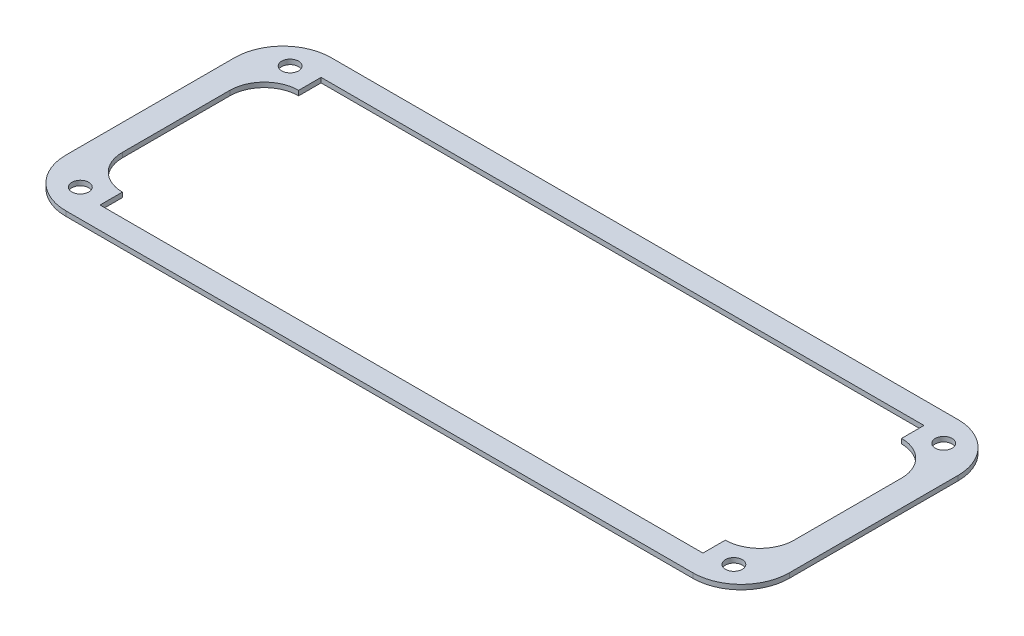
from build123d import *

# Parameters (mm, degrees)
SKETCH1_R           = 1.75
BOSS_EXTRUDE1_DEPTH = 1


with BuildPart() as part:
    # Sketch1 → Boss-Extrude1 (new body)
    with BuildSketch(Plane(origin=(0, 0, 0), x_dir=(1, 0, 0), z_dir=(0, 1, 0))):
        with BuildLine():
            Line((132.75, -5.75), (2.75, -5.75))
            ThreePointArc((2.75, -5.75), (-4.321067812, -2.821067812), (-7.25, 4.25))
            Line((-7.25, 4.25), (-7.25, 39.25))
            ThreePointArc((-7.25, 39.25), (-4.321067812, 46.321067812), (2.75, 49.25))
            Line((2.75, 49.25), (132.75, 49.25))
            ThreePointArc((132.75, 49.25), (139.821067812, 46.321067812), (142.75, 39.25))
            Line((142.75, 39.25), (142.75, 4.25))
            ThreePointArc((142.75, 4.25), (139.821067812, -2.821067812), (132.75, -5.75))
        make_face()
        with Locations(Location((0, 0, 0), (0, 0, 270))):
            Circle(SKETCH1_R, mode=Mode.SUBTRACT)
        with Locations(Location((0, 43.5, 0), (0, 0, 270))):
            Circle(SKETCH1_R, mode=Mode.SUBTRACT)
        with Locations(Location((135.5, 43.5, 0), (0, 0, 270))):
            Circle(SKETCH1_R, mode=Mode.SUBTRACT)
        with Locations(Location((135.5, 0, 0), (0, 0, 270))):
            Circle(SKETCH1_R, mode=Mode.SUBTRACT)
        with BuildLine():
            Line((130.25, 40.016443463), (130.25, 44.666666667))
            Line((130.25, 44.666666667), (5.25, 44.666666667))
            Line((5.25, 44.666666667), (5.25, 40.020251196))
            ThreePointArc((5.25, 40.020251196), (0.205636176, 37.930807287), (-1.883807733, 32.886443463))
            Line((-1.883807733, 32.886443463), (-1.883807733, 10.613556537))
            ThreePointArc((-1.883807733, 10.613556537), (0.205636176, 5.569192713), (5.25, 3.479748804))
            Line((5.25, 3.479748804), (5.25, -1.166666667))
            Line((5.25, -1.166666667), (130.25, -1.166666667))
            Line((130.25, -1.166666667), (130.25, 3.483556537))
            ThreePointArc((130.25, 3.483556537), (135.29167135, 5.571885187), (137.38, 10.613556537))
            Line((137.38, 10.613556537), (137.38, 32.886443463))
            ThreePointArc((137.38, 32.886443463), (135.29167135, 37.928114813), (130.25, 40.016443463))
        make_face(mode=Mode.SUBTRACT)
    extrude(amount=BOSS_EXTRUDE1_DEPTH)


solid = part.part
